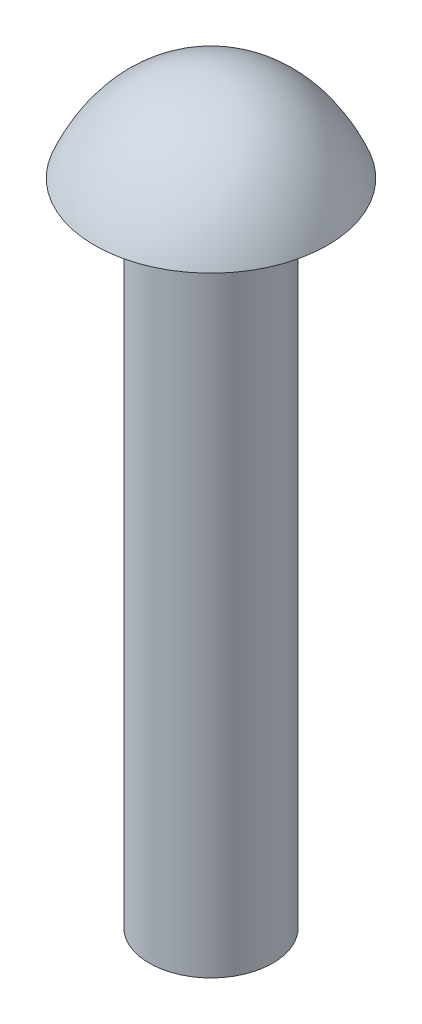
from build123d import *


with BuildPart() as part:
    # Sketch3 → Revolve1 (revolve)
    with BuildSketch(Plane.XY, mode=Mode.PRIVATE) as revolve1_sk:
        with BuildLine():
            Line((-18.293650503, 0), (-15.880650503, 0))
            Line((-15.880650503, 0), (-15.880650503, 25.4))
            Line((-15.880650503, 25.4), (-13.734350503, 25.4))
            add(Edge.make_bspline(
                [(-13.734350503, 25.4), (-13.95828444, 25.946693156), (-15.177343152, 28.8798), (-18.293650503, 28.8798)],
                knots=[0, 0, 0, 0, 1, 1, 1, 1], degree=3))
            Line((-18.293650503, 28.8798), (-18.293650503, 0))
        make_face()
    revolve(revolve1_sk.sketch.rotate(Axis((-18.293650503, 0, 0), (0, 1, 0)), 90), axis=Axis((-18.293650503, 0, 0), (0, 1, 0)))


solid = part.part
